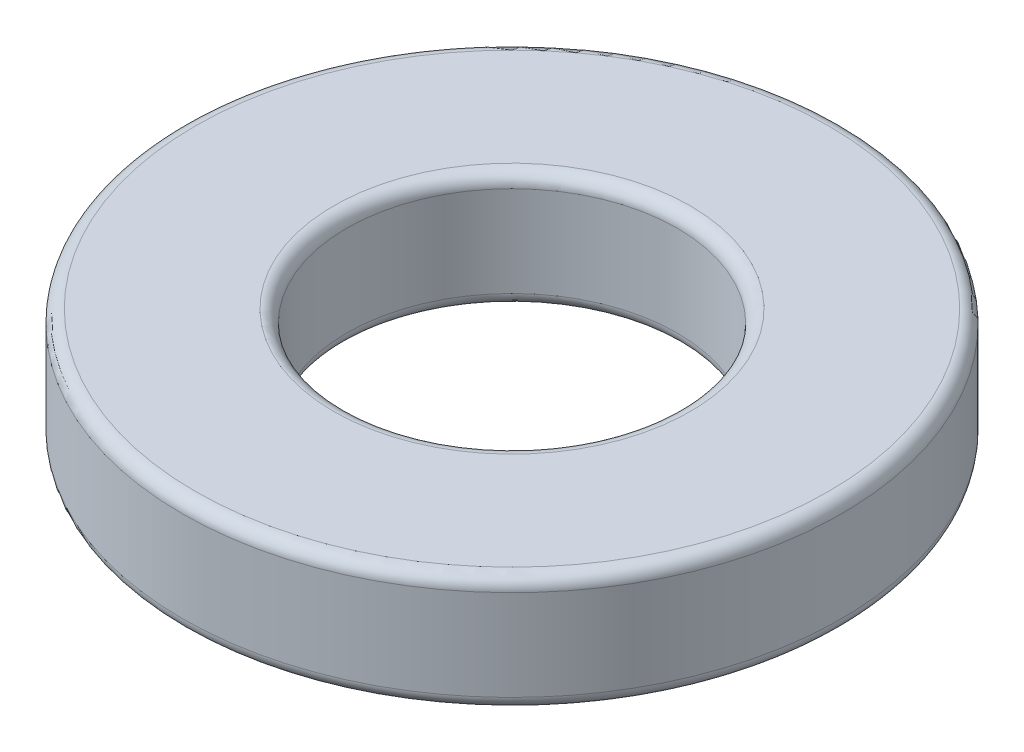
from build123d import *

# Parameters (mm, degrees)
SKETCH1_R           = 25.425
SKETCH1_R_2         = 12.75
BOSS_EXTRUDE1_DEPTH = 9
FILLET1_R           = 1


with BuildPart() as part:
    # Sketch1 → Boss-Extrude1 (new body)
    with BuildSketch(Plane(origin=(0, 0, 0), x_dir=(1, 0, 0), z_dir=(0, 1, 0))):
        with Locations(Location((0, 0, 0), (0, 0, 270))):
            Circle(SKETCH1_R)
        with Locations(Location((0, 0, 0), (0, 0, 270))):
            Circle(SKETCH1_R_2, mode=Mode.SUBTRACT)
    extrude(amount=BOSS_EXTRUDE1_DEPTH)

    # Fillet1
    fillet1_edges = [part.edges().sort_by_distance(p)[0] for p in [
        (0, 0, -25.425),
        (0, 9, -25.425),
        (0, 0, -12.75),
        (0, 9, -12.75),
    ]]
    fillet(fillet1_edges, radius=FILLET1_R)


solid = part.part
